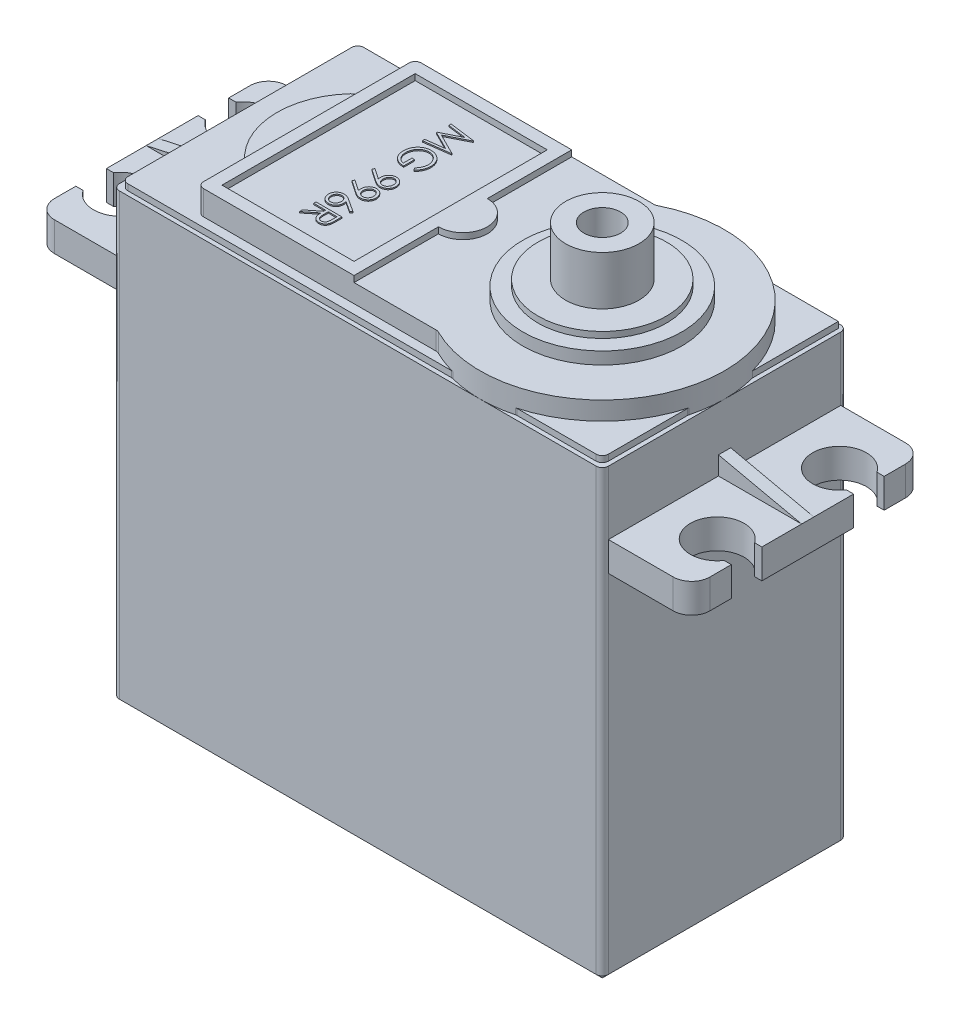
from build123d import *

# Parameters (mm, degrees)
SKETCH2_W                 = 40
SKETCH2_H                 = 20
BOSS_EXTRUDE1_DEPTH       = 38
BOSS_EXTRUDE2_DEPTH       = 2
BOSS_EXTRUDE3_DEPTH       = 0.5
SKETCH5_W                 = 12.8
SKETCH5_H                 = 17.8
SKETCH5_W_2               = 10.8
SKETCH5_H_2               = 15.8
BOSS_EXTRUDE4_DEPTH       = 0.5
BOSS_EXTRUDE5_DEPTH       = 0.5
SKETCH7_R                 = 6.5
BOSS_EXTRUDE6_DEPTH       = 1
SKETCH8_R                 = 5.25
BOSS_EXTRUDE7_DEPTH       = 0.5
SKETCH9_R                 = 3
BOSS_EXTRUDE8_DEPTH       = 4
SKETCH10_R                = 1.5
CUT_EXTRUDE1_DEPTH        = 10
CHAMFER1_SIZE             = 2
SKETCH11_R                = 2.828427125
CUT_EXTRUDE2_DEPTH        = 2
FILLET1_R                 = 0.5
FILLET2_R                 = 0.5
BOSS_EXTRUDE9_DEPTH       = 2.4
BOSS_EXTRUDE10_DEPTH      = 0.5
BOSS_EXTRUDE10_DEPTH_BACK = 0.5
BOSS_EXTRUDE11_DEPTH      = 0.1
FILLET3_R                 = 1.5


with BuildPart() as part:
    # Sketch2 → Boss-Extrude1 (new body)
    with BuildSketch(Plane(origin=(0, 0, 0), x_dir=(1, 0, 0), z_dir=(0, 1, 0))):
        Rectangle(SKETCH2_W, SKETCH2_H)
    extrude(amount=BOSS_EXTRUDE1_DEPTH)

    # Sketch3 → Boss-Extrude2 (add)
    with BuildSketch(Plane(origin=(0, 38, 0), x_dir=(1, 0, 0), z_dir=(0, 1, 0))):
        with BuildLine():
            ThreePointArc((5.440394754, 8.9), (0, 0), (5.440394754, -8.9))
            Line((5.440394754, -8.9), (5.440394754, 8.9))
        make_face()
        with BuildLine():
            Line((5.440394754, 8.9), (5.440394754, -8.9))
            ThreePointArc((5.440394754, -8.9), (15.215551147, -8.532175938), (20, 0))
            ThreePointArc((20, 0), (15.215551147, 8.532175938), (5.440394754, 8.9))
        make_face()
        with BuildLine():
            Line((-14.2, -5), (-14.2, -8.9))
            Line((-14.2, -8.9), (5.440394754, -8.9))
            ThreePointArc((5.440394754, -8.9), (0, 0), (5.440394754, 8.9))
            Line((5.440394754, 8.9), (-14.2, 8.9))
            Line((-14.2, 8.9), (-14.2, 5))
            ThreePointArc((-14.2, 5), (-7.418581742, 5.77726026), (-3.783333333, 0))
            ThreePointArc((-3.783333333, 0), (-7.418581742, -5.77726026), (-14.2, -5))
        make_face()
        with BuildLine():
            ThreePointArc((-14.2, 5), (-16.6, 0), (-14.2, -5))
            Line((-14.2, -5), (-14.2, 5))
        make_face()
        with BuildLine():
            Line((-14.2, 5), (-14.2, -5))
            ThreePointArc((-14.2, -5), (-7.418581742, -5.77726026), (-3.783333333, 0))
            ThreePointArc((-3.783333333, 0), (-7.418581742, 5.77726026), (-14.2, 5))
        make_face()
    extrude(amount=BOSS_EXTRUDE2_DEPTH)

    # Sketch4 → Boss-Extrude3 (add)
    with BuildSketch(Plane(origin=(0, 38, 0), x_dir=(1, 0, 0), z_dir=(0, 1, 0))):
        Polygon((-19.65, 9.65), (-19.65, -9.65), (10, -9.65), (19.65, -9.65), (19.65, 0), (19.65, 9.65), (10, 9.65), align=None)
    extrude(amount=BOSS_EXTRUDE3_DEPTH)

    # Sketch5 → Boss-Extrude4 (add)
    with BuildSketch(Plane(origin=(0, 40, 0), x_dir=(1, 0, 0), z_dir=(0, 1, 0))):
        with Locations((-7.8, 0)):
            Rectangle(SKETCH5_W, SKETCH5_H)
        with Locations((-7.8, 0)):
            Rectangle(SKETCH5_W_2, SKETCH5_H_2, mode=Mode.SUBTRACT)
    extrude(amount=BOSS_EXTRUDE4_DEPTH)

    # Sketch6 → Boss-Extrude5 (add)
    with BuildSketch(Plane(origin=(0, 40, 0), x_dir=(1, 0, 0), z_dir=(0, 1, 0))):
        with BuildLine():
            ThreePointArc((0.6, 0), (0.014213562, 1.414213562), (-1.4, 2))
            Line((-1.4, 2), (-1.4, -2))
            ThreePointArc((-1.4, -2), (0.014213562, -1.414213562), (0.6, 0))
        make_face()
    extrude(amount=BOSS_EXTRUDE5_DEPTH)

    # Sketch7 → Boss-Extrude6 (add)
    with BuildSketch(Plane(origin=(0, 40, 0), x_dir=(1, 0, 0), z_dir=(0, 1, 0))):
        with Locations(Location((10, 0, 0), (0, 0, 270))):
            Circle(SKETCH7_R)
    extrude(amount=BOSS_EXTRUDE6_DEPTH)

    # Sketch8 → Boss-Extrude7 (add)
    with BuildSketch(Plane(origin=(0, 41, 0), x_dir=(1, 0, 0), z_dir=(0, 1, 0))):
        with Locations(Location((10, 0, 0), (0, 0, 270))):
            Circle(SKETCH8_R)
    extrude(amount=BOSS_EXTRUDE7_DEPTH)

    # Sketch9 → Boss-Extrude8 (add)
    with BuildSketch(Plane(origin=(0, 41.5, 0), x_dir=(1, 0, 0), z_dir=(0, 1, 0))):
        with Locations(Location((10, 0, 0), (0, 0, 270))):
            Circle(SKETCH9_R)
    extrude(amount=BOSS_EXTRUDE8_DEPTH)

    # Sketch10 → Cut-Extrude1 (cut)
    with BuildSketch(Plane(origin=(0, 45.5, 0), x_dir=(1, 0, 0), z_dir=(0, 1, 0))):
        with Locations(Location((10, 0, 0), (0, 0, 270))):
            Circle(SKETCH10_R)
    extrude(amount=-CUT_EXTRUDE1_DEPTH, mode=Mode.SUBTRACT)

    # Chamfer1
    chamfer1_edges = [part.edges().sort_by_distance(p)[0] for p in [
        (0, 0, 10),
        (-20, 0, 0),
        (0, 0, -10),
        (20, 0, 0),
    ]]
    chamfer(chamfer1_edges, length=CHAMFER1_SIZE)

    # Sketch11 → Cut-Extrude2 (cut)
    with BuildSketch(Plane.XZ):
        with Locations((-20, 10)):
            Circle(SKETCH11_R)
        with Locations((20, 10)):
            Circle(SKETCH11_R)
        with Locations((20, -10)):
            Circle(SKETCH11_R)
        with Locations((-20, -10)):
            Circle(SKETCH11_R)
    extrude(amount=-CUT_EXTRUDE2_DEPTH, mode=Mode.SUBTRACT)

    # Fillet1
    fillet1_edges = [part.edges().sort_by_distance(p)[0] for p in [
        (20, 20, 10),
        (-20, 20, 10),
        (-20, 20, -10),
        (20, 20, -10),
    ]]
    fillet(fillet1_edges, radius=FILLET1_R)

    # Fillet2
    fillet2_edges = [part.edges().sort_by_distance(p)[0] for p in [
        (5.440394754, 39.25, 8.9),
        (5.440394754, 39.25, -8.9),
        (-14.2, 39.5, -8.9),
        (-14.2, 39.25, -5),
        (-14.2, 39.25, 5),
        (-14.2, 39.5, 8.9),
        (7.377501192, 38.25, 9.65),
        (7.377501192, 38.25, -9.65),
        (19.65, 38.25, 2.622498808),
        (12.622498808, 38.25, 9.65),
        (-19.65, 38.25, 9.65),
        (19.65, 38.25, 9.65),
        (-19.65, 38.25, -9.65),
    ]]
    fillet(fillet2_edges, radius=FILLET2_R)

    # Sketch13 → Boss-Extrude9 (add)
    with BuildSketch(Plane(origin=(0, 32.8, 0), x_dir=(1, 0, 0), z_dir=(0, 1, 0))):
        with BuildLine():
            Line((-26.210386699, -6.25), (-26.8, -6.25))
            Line((-26.8, -6.25), (-26.8, -9.5))
            Line((-26.8, -9.5), (-20, -9.5))
            Line((-20, -9.5), (-20, 9.5))
            Line((-20, 9.5), (-26.8, 9.5))
            Line((-26.8, 9.5), (-26.8, 6.25))
            Line((-26.8, 6.25), (-26.210386699, 6.25))
            ThreePointArc((-26.210386699, 6.25), (-23.745343883, 7.100339346), (-22.2, 5))
            ThreePointArc((-22.2, 5), (-22.844365081, 3.444365081), (-24.4, 2.8))
            Line((-24.4, 2.8), (-24.4, -2.8))
            ThreePointArc((-24.4, -2.8), (-22.844365081, -3.444365081), (-22.2, -5))
            ThreePointArc((-22.2, -5), (-23.745343883, -7.100339346), (-26.210386699, -6.25))
        make_face()
        with BuildLine():
            Line((-26.8, 3.75), (-26.8, -3.75))
            Line((-26.8, -3.75), (-26.210386699, -3.75))
            ThreePointArc((-26.210386699, -3.75), (-25.422252415, -3.051924026), (-24.4, -2.8))
            Line((-24.4, -2.8), (-24.4, 2.8))
            ThreePointArc((-24.4, 2.8), (-25.422252415, 3.051924026), (-26.210386699, 3.75))
            Line((-26.210386699, 3.75), (-26.8, 3.75))
        make_face()
        with BuildLine():
            Line((26.8, 9.5), (20, 9.5))
            Line((20, 9.5), (20, -9.5))
            Line((20, -9.5), (26.8, -9.5))
            Line((26.8, -9.5), (26.8, -6.25))
            Line((26.8, -6.25), (26.210386699, -6.25))
            ThreePointArc((26.210386699, -6.25), (22.451924026, -6.022252415), (24.4, -2.8))
            Line((24.4, -2.8), (24.4, 2.8))
            ThreePointArc((24.4, 2.8), (22.451924026, 6.022252415), (26.210386699, 6.25))
            Line((26.210386699, 6.25), (26.8, 6.25))
            Line((26.8, 6.25), (26.8, 9.5))
        make_face()
        with BuildLine():
            Line((26.8, -3.75), (26.8, 3.75))
            Line((26.8, 3.75), (26.210386699, 3.75))
            ThreePointArc((26.210386699, 3.75), (25.422252415, 3.051924026), (24.4, 2.8))
            Line((24.4, 2.8), (24.4, -2.8))
            ThreePointArc((24.4, -2.8), (25.422252415, -3.051924026), (26.210386699, -3.75))
            Line((26.210386699, -3.75), (26.8, -3.75))
        make_face()
    extrude(amount=-BOSS_EXTRUDE9_DEPTH)

    # Sketch14 → Boss-Extrude10 (add, two sides: drawn at the far end of the back side and taken through both)
    with BuildSketch(Plane.XY.offset(-BOSS_EXTRUDE10_DEPTH_BACK)):
        Polygon((20, 34.3), (26.8, 32.8), (20, 32.8), align=None)
        Polygon((-20, 32.8), (-26.8, 32.8), (-20, 34.3), align=None)
    extrude(amount=BOSS_EXTRUDE10_DEPTH + BOSS_EXTRUDE10_DEPTH_BACK)

    # Sketch15 → Boss-Extrude11 (add)
    # profile 1 of 6: a face of its own
    with BuildSketch(Plane(origin=(0, 40, 0), x_dir=(1, 0, 0), z_dir=(0, 1, 0))):
        Polygon((-8.561548725, 6.200747863), (-6.444882058, 5.921324119), (-6.444882058, 5.894187366), (-8.181634195, 5.020299145), (-6.444882058, 4.148530983), (-6.444882058, 4.120970219), (-8.561548725, 3.839850427), (-8.561548725, 4.030655716), (-7.038498511, 4.233333333), (-8.561548725, 4.997402511), (-8.561548725, 5.040227698), (-7.035106417, 5.807264957), (-8.561548725, 6.009518563), align=None)
    # profile 2 of 6: a face of its own
    with BuildSketch(Plane(origin=(0, 40, 0), x_dir=(1, 0, 0), z_dir=(0, 1, 0))):
        with BuildLine():
            Line((-6.806140071, 1.424679487), (-6.960480348, 1.5875))
            add(Edge.make_bspline(
                [(-6.960480348, 1.5875), (-6.932810967, 1.617141776), (-6.878278885, 1.675561142), (-6.80662192, 1.770186257), (-6.746314601, 1.86944475), (-6.696391634, 1.971860294), (-6.656919261, 2.075604624), (-6.628967869, 2.179013721), (-6.610865102, 2.280971117), (-6.608747952, 2.348670327), (-6.607702571, 2.382098024)],
                knots=[0, 0, 0, 0, 1.09204548, 2.152253107, 3.191356492, 4.216655925, 5.218178745, 6.177092199, 7.099906635, 8, 8, 8, 8], degree=3))
            add(Edge.make_bspline(
                [(-6.607702571, 2.382098024), (-6.607953073, 2.402608227), (-6.608453428, 2.44357544), (-6.61482467, 2.504429471), (-6.624016441, 2.564637149), (-6.637179143, 2.623990847), (-6.654275269, 2.682726549), (-6.674916288, 2.740713594), (-6.699763682, 2.797840051), (-6.728091949, 2.853805452), (-6.759017048, 2.908338456), (-6.793507197, 2.959627677), (-6.830503248, 3.007883988), (-6.87048222, 3.052777152), (-6.912808712, 3.094881359), (-6.958058639, 3.133649558), (-7.005903564, 3.169276199), (-7.056339068, 3.201350739), (-7.108218655, 3.229989232), (-7.161069102, 3.255321041), (-7.214835326, 3.276378841), (-7.269205905, 3.29385362), (-7.324294202, 3.307543871), (-7.380101658, 3.317338355), (-7.436818766, 3.322821216), (-7.474795627, 3.32377344), (-7.493887133, 3.324252137)],
                knots=[0, 0, 0, 0, 1.028345126, 2.054023193, 3.065714254, 4.082262095, 5.100859654, 6.132352297, 7.167492809, 8.223256921, 9.277568108, 10.309840045, 11.320860232, 12.32524711, 13.322830633, 14.313234294, 15.3114222, 16.312425732, 17.308799391, 18.282312954, 19.249923241, 20.202773571, 21.145015718, 22.094907699, 23.042283124, 24, 24, 24, 24], degree=3))
            add(Edge.make_bspline(
                [(-7.493887133, 3.324252137), (-7.513402204, 3.323791035), (-7.552379057, 3.32287009), (-7.610569839, 3.317088711), (-7.667784816, 3.306022676), (-7.724660506, 3.292391015), (-7.780460079, 3.273405367), (-7.835808383, 3.25102033), (-7.890199064, 3.224186229), (-7.943301216, 3.193217907), (-7.995020793, 3.159233867), (-8.04374052, 3.12116956), (-8.09010677, 3.080734487), (-8.133090712, 3.0364576), (-8.173841918, 2.989758138), (-8.211237688, 2.939241006), (-8.245998327, 2.885899516), (-8.277685746, 2.829652298), (-8.305993766, 2.771109663), (-8.331166312, 2.71108296), (-8.35189715, 2.649380424), (-8.368793051, 2.586326321), (-8.382642278, 2.521995819), (-8.391551921, 2.456062376), (-8.398017328, 2.389010786), (-8.398490052, 2.343811708), (-8.398728212, 2.321040331)],
                knots=[0, 0, 0, 0, 0.935842715, 1.869129955, 2.799583258, 3.728257868, 4.6712142, 5.62263184, 6.589468525, 7.576334199, 8.568768874, 9.554260682, 10.538610026, 11.516240982, 12.510802173, 13.508383516, 14.52719334, 15.561971611, 16.601598616, 17.64369662, 18.68095744, 19.719943675, 20.77263142, 21.833597991, 22.908562741, 24, 24, 24, 24], degree=3))
            add(Edge.make_bspline(
                [(-8.398728212, 2.321040331), (-8.398154549, 2.293597235), (-8.397028069, 2.239708258), (-8.388258845, 2.160492649), (-8.374562931, 2.084411739), (-8.354505447, 2.011679341), (-8.328921843, 1.942210858), (-8.298081601, 1.875752074), (-8.260802879, 1.81282455), (-8.218724818, 1.753245395), (-8.171855725, 1.698344593), (-8.121238623, 1.648893856), (-8.067368749, 1.605427514), (-8.009770291, 1.568307131), (-7.949364291, 1.536328164), (-7.885075037, 1.510826334), (-7.817631427, 1.491099952), (-7.771005497, 1.483030405), (-7.74744616, 1.478952991)],
                knots=[0, 0, 0, 0, 1.13011591, 2.219166196, 3.278784489, 4.311187005, 5.322345388, 6.325022048, 7.324448642, 8.33076908, 9.325913853, 10.293360401, 11.241630175, 12.171712957, 13.111744789, 14.052245185, 15.015830637, 16, 16, 16, 16], degree=3))
            Line((-7.74744616, 1.478952991), (-7.74744616, 2.184508547))
            Line((-7.74744616, 2.184508547), (-7.530352143, 2.184508547))
            Line((-7.530352143, 2.184508547), (-7.530352143, 1.288995726))
            add(Edge.make_bspline(
                [(-7.530352143, 1.288995726), (-7.570815244, 1.290027359), (-7.65000884, 1.292046449), (-7.765500385, 1.306209317), (-7.874582314, 1.329079303), (-7.977369505, 1.360321492), (-8.073716297, 1.400765114), (-8.163720511, 1.449976119), (-8.246800694, 1.508742116), (-8.323635092, 1.574969859), (-8.392172282, 1.649295072), (-8.452410159, 1.729709428), (-8.503151264, 1.816345785), (-8.544432712, 1.909122192), (-8.576650795, 2.00773493), (-8.599493606, 2.112412189), (-8.613179345, 2.223012014), (-8.614927941, 2.298810861), (-8.615822229, 2.33757679)],
                knots=[0, 0, 0, 0, 1.140356446, 2.231883559, 3.274166699, 4.278491846, 5.25512956, 6.21435461, 7.1637429, 8.11826594, 9.068280886, 10.0076534, 10.945064095, 11.891975133, 12.864533718, 13.863980011, 14.907571808, 16, 16, 16, 16], degree=3))
            add(Edge.make_bspline(
                [(-8.615822229, 2.33757679), (-8.615478046, 2.361471014), (-8.614799206, 2.408598126), (-8.609974811, 2.478200735), (-8.602547986, 2.545884249), (-8.591332602, 2.611638806), (-8.577595644, 2.67570628), (-8.560005105, 2.737766696), (-8.539643558, 2.798056463), (-8.516483794, 2.856668769), (-8.489649506, 2.913071614), (-8.459828914, 2.967516222), (-8.427175787, 3.020303546), (-8.391125418, 3.071074012), (-8.351947454, 3.120092155), (-8.30956337, 3.167041904), (-8.26410274, 3.212186097), (-8.231821149, 3.240465044), (-8.215555135, 3.254714209)],
                knots=[0, 0, 0, 0, 1.107784379, 2.184907829, 3.233506516, 4.263428166, 5.276301166, 6.270063455, 7.25232949, 8.225834625, 9.190232166, 10.146266622, 11.1027726, 12.066435141, 13.031522626, 14.010570082, 14.99756817, 16, 16, 16, 16], degree=3))
            add(Edge.make_bspline(
                [(-8.215555135, 3.254714209), (-8.189749549, 3.275388559), (-8.138566725, 3.316394084), (-8.056561044, 3.369176589), (-7.971651348, 3.414171723), (-7.883601263, 3.450679882), (-7.792493148, 3.479187201), (-7.698443425, 3.499631935), (-7.601330981, 3.511610629), (-7.535614369, 3.513336339), (-7.502367368, 3.514209402)],
                knots=[0, 0, 0, 0, 1.023165419, 2.029347347, 3.013907458, 3.994755782, 4.975994455, 5.96558838, 6.970761222, 8, 8, 8, 8], degree=3))
            add(Edge.make_bspline(
                [(-7.502367368, 3.514209402), (-7.477471848, 3.513886652), (-7.427997216, 3.513245255), (-7.354540612, 3.505501702), (-7.282406505, 3.494325229), (-7.211528085, 3.478136556), (-7.142220096, 3.456836256), (-7.073949701, 3.43125565), (-7.006990819, 3.401292598), (-6.941932978, 3.366330162), (-6.878813215, 3.328261658), (-6.81956397, 3.285499792), (-6.76316018, 3.240150202), (-6.710623529, 3.190930726), (-6.66172523, 3.138120193), (-6.616284106, 3.082011022), (-6.574184016, 3.022630631), (-6.536102939, 2.959773118), (-6.501895232, 2.89438185), (-6.471905615, 2.826612167), (-6.447120454, 2.756485136), (-6.426090601, 2.684526037), (-6.410539062, 2.610190217), (-6.399261012, 2.534017106), (-6.391543887, 2.455609658), (-6.390923247, 2.402610726), (-6.390608554, 2.375737847)],
                knots=[0, 0, 0, 0, 1.009014138, 2.005204323, 2.991638015, 3.967544938, 4.950092358, 5.929358695, 6.922031709, 7.921874511, 8.922406847, 9.908357674, 10.882125353, 11.855201406, 12.82437151, 13.798139189, 14.780770167, 15.773426639, 16.775664355, 17.771244468, 18.775446331, 19.789330884, 20.808771541, 21.851841802, 22.910785716, 24, 24, 24, 24], degree=3))
            add(Edge.make_bspline(
                [(-6.390608554, 2.375737847), (-6.390958132, 2.353822178), (-6.391651306, 2.31036598), (-6.396480839, 2.245703717), (-6.404050769, 2.182168228), (-6.414636047, 2.119440796), (-6.428638655, 2.057760259), (-6.445703782, 1.996939746), (-6.465461901, 1.937094288), (-6.489044269, 1.878295081), (-6.515806248, 1.820142357), (-6.545931764, 1.762313966), (-6.579934434, 1.705007169), (-6.617915639, 1.648122675), (-6.659222939, 1.59130175), (-6.705037781, 1.535443133), (-6.753553448, 1.479198495), (-6.788437435, 1.443032636), (-6.806140071, 1.424679487)],
                knots=[0, 0, 0, 0, 0.985875312, 1.954874891, 2.915472732, 3.863573565, 4.815313299, 5.759461513, 6.704487138, 7.649063459, 8.607849844, 9.583336382, 10.581114205, 11.603942397, 12.659508253, 13.739925933, 14.853076422, 16, 16, 16, 16], degree=3))
        make_face()
    # profile 3 of 6: a face of its own
    with BuildSketch(Plane(origin=(0, 40, 0), x_dir=(1, 0, 0), z_dir=(0, 1, 0))):
        with BuildLine():
            Line((-8.615822229, -0.230662393), (-8.510243303, -0.078866186))
            Line((-8.510243303, -0.078866186), (-7.649923457, -0.667394498))
            add(Edge.make_bspline(
                [(-7.649923457, -0.667394498), (-7.654515453, -0.629844386), (-7.663557348, -0.555906123), (-7.66521842, -0.481437495), (-7.666035904, -0.444788328)],
                knots=[0, 0, 0, 0, 1.015715272, 2, 2, 2, 2], degree=3))
            add(Edge.make_bspline(
                [(-7.666035904, -0.444788328), (-7.665465089, -0.422568752), (-7.664344629, -0.378953667), (-7.655513825, -0.314821021), (-7.641758816, -0.253105896), (-7.621709949, -0.194043366), (-7.596086972, -0.137686046), (-7.564874842, -0.083837274), (-7.527957379, -0.032568352), (-7.48573141, 0.015517442), (-7.439357742, 0.059248093), (-7.390278343, 0.09820904), (-7.337920379, 0.130588628), (-7.28335261, 0.157486385), (-7.225790547, 0.177885275), (-7.165889245, 0.192739763), (-7.103228871, 0.201885187), (-7.060577958, 0.202973211), (-7.038922523, 0.203525641)],
                knots=[0, 0, 0, 0, 1.060702494, 2.082066239, 3.085748733, 4.076089625, 5.054723785, 6.037561548, 7.043420247, 8.066922603, 9.088643095, 10.08373341, 11.053858765, 12.022809492, 12.983497605, 13.964038393, 14.966267459, 16, 16, 16, 16], degree=3))
            add(Edge.make_bspline(
                [(-7.038922523, 0.203525641), (-7.009308147, 0.202476721), (-6.951181135, 0.200417904), (-6.866252141, 0.183848324), (-6.785947898, 0.156597548), (-6.710479543, 0.118601339), (-6.640932686, 0.070743674), (-6.578274147, 0.013225622), (-6.523395116, -0.053602966), (-6.476221221, -0.128219711), (-6.438281485, -0.208866538), (-6.410317718, -0.293332822), (-6.393868951, -0.380971361), (-6.391700359, -0.440339428), (-6.390608554, -0.470229033)],
                knots=[0, 0, 0, 0, 1.022988612, 2.007919123, 2.978103895, 3.94594894, 4.918897164, 5.887013414, 6.875921846, 7.89917871, 8.930658928, 9.948724884, 10.967259574, 12, 12, 12, 12], degree=3))
            add(Edge.make_bspline(
                [(-6.390608554, -0.470229033), (-6.391711389, -0.499554125), (-6.393890488, -0.557497742), (-6.409989707, -0.642817912), (-6.436834093, -0.724608652), (-6.474101775, -0.802226446), (-6.521118713, -0.873720655), (-6.576681277, -0.938257711), (-6.64141553, -0.994108657), (-6.7135508, -1.041177485), (-6.791062879, -1.078955938), (-6.871969886, -1.106214213), (-6.955692458, -1.122993647), (-7.012415768, -1.125108102), (-7.041042581, -1.126175214)],
                knots=[0, 0, 0, 0, 1.026337322, 2.02794581, 3.027878252, 4.032696425, 5.033228651, 6.015458494, 7.004668777, 8.016190509, 9.023163053, 10.0152653, 10.998354841, 12, 12, 12, 12], degree=3))
            add(Edge.make_bspline(
                [(-7.041042581, -1.126175214), (-7.063265591, -1.125471359), (-7.108339407, -1.124043767), (-7.176756075, -1.113788054), (-7.246659676, -1.097177732), (-7.305904252, -1.077910467), (-7.354338889, -1.058180733), (-7.39320891, -1.041205888), (-7.43377282, -1.021448467), (-7.475732488, -0.997979546), (-7.520191871, -0.973443639), (-7.566180028, -0.945545859), (-7.613953944, -0.915135235), (-7.646154795, -0.893465055), (-7.66264381, -0.882368456)],
                knots=[0, 0, 0, 0, 1.179688711, 2.392703466, 3.66501481, 4.991562144, 5.695278944, 6.441221078, 7.243328977, 8.089575748, 8.993388627, 9.939305498, 10.944784961, 12, 12, 12, 12], degree=3))
            Line((-7.66264381, -0.882368456), (-8.615822229, -0.230662393))
        make_face()
        with BuildLine():
            add(Edge.make_bspline(
                [(-7.448941887, -0.479981303), (-7.448482036, -0.496814255), (-7.447586862, -0.529582289), (-7.442138416, -0.577586655), (-7.432477957, -0.622897959), (-7.418616989, -0.665637239), (-7.401891289, -0.706233032), (-7.380596421, -0.744040525), (-7.355186361, -0.779091361), (-7.326635542, -0.811620251), (-7.294915427, -0.840506098), (-7.261715748, -0.866234502), (-7.22689077, -0.888103036), (-7.190004368, -0.905377018), (-7.151954438, -0.919579594), (-7.112128232, -0.92938763), (-7.070733247, -0.934821013), (-7.04261263, -0.935747251), (-7.028322229, -0.936217949)],
                knots=[0, 0, 0, 0, 1.163407946, 2.26475976, 3.333800367, 4.359385343, 5.366239384, 6.363380779, 7.350133999, 8.353570782, 9.349036268, 10.310270964, 11.253520213, 12.184142, 13.120487599, 14.056272588, 15.012232024, 16, 16, 16, 16], degree=3))
            add(Edge.make_bspline(
                [(-7.028322229, -0.936217949), (-7.014025829, -0.935812995), (-6.985853018, -0.935014984), (-6.944397196, -0.92861166), (-6.904666744, -0.917349802), (-6.86645419, -0.902229162), (-6.830035937, -0.882347874), (-6.795174436, -0.858401984), (-6.761438784, -0.830511008), (-6.730566414, -0.797779052), (-6.701740554, -0.762562584), (-6.676751595, -0.724697037), (-6.655420763, -0.685121664), (-6.637969282, -0.64380493), (-6.624323924, -0.600660833), (-6.614518181, -0.55568704), (-6.609091887, -0.508663884), (-6.608171575, -0.476743724), (-6.607702571, -0.460476763)],
                knots=[0, 0, 0, 0, 0.972051712, 1.915547132, 2.843788449, 3.775556853, 4.704594175, 5.659091977, 6.648619647, 7.675179132, 8.714041218, 9.74046568, 10.755438548, 11.767722258, 12.786148662, 13.828784001, 14.893517844, 16, 16, 16, 16], degree=3))
            add(Edge.make_bspline(
                [(-6.607702571, -0.460476763), (-6.608172247, -0.444351233), (-6.609093748, -0.412713077), (-6.614508827, -0.366108536), (-6.624386378, -0.321436711), (-6.637975872, -0.278425438), (-6.65532584, -0.237195791), (-6.676751434, -0.197935219), (-6.701874032, -0.160464245), (-6.730529707, -0.12525782), (-6.761586997, -0.092596047), (-6.795027032, -0.06421388), (-6.830054393, -0.040323477), (-6.866449285, -0.020414623), (-6.904668053, -0.005301316), (-6.944396841, 0.005962506), (-6.985853111, 0.012365303), (-7.01402586, 0.013163386), (-7.028322229, 0.013568376)],
                knots=[0, 0, 0, 0, 1.099545523, 2.15729926, 3.193054709, 4.213957097, 5.228701859, 6.237665598, 7.258567987, 8.299955741, 9.329010984, 10.327149711, 11.283968076, 12.215264062, 13.149297769, 14.079795814, 15.025585048, 16, 16, 16, 16], degree=3))
            add(Edge.make_bspline(
                [(-7.028322229, 0.013568376), (-7.042623759, 0.013201935), (-7.070828993, 0.012479246), (-7.112271145, 0.005507678), (-7.151996862, -0.006151091), (-7.190392413, -0.021765675), (-7.227084442, -0.042328541), (-7.261898989, -0.067561535), (-7.295230714, -0.097137746), (-7.326561742, -0.130661808), (-7.355319486, -0.1673516), (-7.380435479, -0.206538204), (-7.401645957, -0.24754701), (-7.418664794, -0.290522377), (-7.432339467, -0.335145823), (-7.442120611, -0.381818402), (-7.447534601, -0.430385765), (-7.448468291, -0.463290849), (-7.448941887, -0.479981303)],
                knots=[0, 0, 0, 0, 0.952633368, 1.87876736, 2.791047057, 3.707742249, 4.635551637, 5.587206343, 6.568248508, 7.601284464, 8.641511608, 9.671105535, 10.699146789, 11.713763218, 12.747829548, 13.806491675, 14.887386225, 16, 16, 16, 16], degree=3))
        make_face(mode=Mode.SUBTRACT)
    # profile 4 of 6: a face of its own
    with BuildSketch(Plane(origin=(0, 40, 0), x_dir=(1, 0, 0), z_dir=(0, 1, 0))):
        with BuildLine():
            Line((-8.615822229, -1.858867521), (-8.510243303, -1.707071314))
            Line((-8.510243303, -1.707071314), (-7.649923457, -2.295599626))
            add(Edge.make_bspline(
                [(-7.649923457, -2.295599626), (-7.654515453, -2.258049515), (-7.663557348, -2.184111251), (-7.66521842, -2.109642623), (-7.666035904, -2.072993456)],
                knots=[0, 0, 0, 0, 1.015715272, 2, 2, 2, 2], degree=3))
            add(Edge.make_bspline(
                [(-7.666035904, -2.072993456), (-7.665465089, -2.05077388), (-7.664344629, -2.007158795), (-7.655513825, -1.943026149), (-7.641758816, -1.881311024), (-7.621709949, -1.822248495), (-7.596086972, -1.765891175), (-7.564874842, -1.712042402), (-7.527957379, -1.66077348), (-7.48573141, -1.612687686), (-7.439357742, -1.568957035), (-7.390278343, -1.529996088), (-7.337920379, -1.497616501), (-7.28335261, -1.470718743), (-7.225790547, -1.450319853), (-7.165889245, -1.435465365), (-7.103228871, -1.426319942), (-7.060577958, -1.425231917), (-7.038922523, -1.424679487)],
                knots=[0, 0, 0, 0, 1.060702494, 2.082066239, 3.085748733, 4.076089625, 5.054723785, 6.037561548, 7.043420247, 8.066922603, 9.088643095, 10.08373341, 11.053858765, 12.022809492, 12.983497605, 13.964038393, 14.966267459, 16, 16, 16, 16], degree=3))
            add(Edge.make_bspline(
                [(-7.038922523, -1.424679487), (-7.009308147, -1.425728407), (-6.951181135, -1.427787225), (-6.866252141, -1.444356804), (-6.785947898, -1.471607581), (-6.710479543, -1.509603789), (-6.640932686, -1.557461454), (-6.578274147, -1.614979506), (-6.523395116, -1.681808094), (-6.476221221, -1.756424839), (-6.438281485, -1.837071666), (-6.410317718, -1.92153795), (-6.393868951, -2.009176489), (-6.391700359, -2.068544556), (-6.390608554, -2.098434161)],
                knots=[0, 0, 0, 0, 1.022988612, 2.007919123, 2.978103895, 3.94594894, 4.918897164, 5.887013414, 6.875921846, 7.89917871, 8.930658928, 9.948724884, 10.967259574, 12, 12, 12, 12], degree=3))
            add(Edge.make_bspline(
                [(-6.390608554, -2.098434161), (-6.391711389, -2.127759253), (-6.393890488, -2.18570287), (-6.409989707, -2.271023041), (-6.436834093, -2.35281378), (-6.474101775, -2.430431574), (-6.521118713, -2.501925783), (-6.576681277, -2.566462839), (-6.64141553, -2.622313785), (-6.7135508, -2.669382613), (-6.791062879, -2.707161066), (-6.871969886, -2.734419341), (-6.955692458, -2.751198775), (-7.012415768, -2.75331323), (-7.041042581, -2.754380342)],
                knots=[0, 0, 0, 0, 1.026337322, 2.02794581, 3.027878252, 4.032696425, 5.033228651, 6.015458494, 7.004668777, 8.016190509, 9.023163053, 10.0152653, 10.998354841, 12, 12, 12, 12], degree=3))
            add(Edge.make_bspline(
                [(-7.041042581, -2.754380342), (-7.063265591, -2.753676488), (-7.108339407, -2.752248895), (-7.176756075, -2.741993182), (-7.246659676, -2.72538286), (-7.305904252, -2.706115595), (-7.354338889, -2.686385861), (-7.39320891, -2.669411017), (-7.43377282, -2.649653596), (-7.475732488, -2.626184674), (-7.520191871, -2.601648767), (-7.566180028, -2.573750987), (-7.613953944, -2.543340364), (-7.646154795, -2.521670183), (-7.66264381, -2.510573584)],
                knots=[0, 0, 0, 0, 1.179688711, 2.392703466, 3.66501481, 4.991562144, 5.695278944, 6.441221078, 7.243328977, 8.089575748, 8.993388627, 9.939305498, 10.944784961, 12, 12, 12, 12], degree=3))
            Line((-7.66264381, -2.510573584), (-8.615822229, -1.858867521))
        make_face()
        with BuildLine():
            add(Edge.make_bspline(
                [(-7.448941887, -2.108186432), (-7.448482036, -2.125019383), (-7.447586862, -2.157787417), (-7.442138416, -2.205791783), (-7.432477957, -2.251103087), (-7.418616989, -2.293842367), (-7.401891289, -2.33443816), (-7.380596421, -2.372245654), (-7.355186361, -2.407296489), (-7.326635542, -2.439825379), (-7.294915427, -2.468711226), (-7.261715748, -2.49443963), (-7.22689077, -2.516308164), (-7.190004368, -2.533582146), (-7.151954438, -2.547784723), (-7.112128232, -2.557592758), (-7.070733247, -2.563026141), (-7.04261263, -2.563952379), (-7.028322229, -2.564423077)],
                knots=[0, 0, 0, 0, 1.163407946, 2.26475976, 3.333800367, 4.359385343, 5.366239384, 6.363380779, 7.350133999, 8.353570782, 9.349036268, 10.310270964, 11.253520213, 12.184142, 13.120487599, 14.056272588, 15.012232024, 16, 16, 16, 16], degree=3))
            add(Edge.make_bspline(
                [(-7.028322229, -2.564423077), (-7.014025829, -2.564018123), (-6.985853018, -2.563220112), (-6.944397196, -2.556816789), (-6.904666744, -2.54555493), (-6.86645419, -2.53043429), (-6.830035937, -2.510553003), (-6.795174436, -2.486607112), (-6.761438784, -2.458716136), (-6.730566414, -2.42598418), (-6.701740554, -2.390767712), (-6.676751595, -2.352902165), (-6.655420763, -2.313326792), (-6.637969282, -2.272010058), (-6.624323924, -2.228865961), (-6.614518181, -2.183892169), (-6.609091887, -2.136869012), (-6.608171575, -2.104948853), (-6.607702571, -2.088681891)],
                knots=[0, 0, 0, 0, 0.972051712, 1.915547132, 2.843788449, 3.775556853, 4.704594175, 5.659091977, 6.648619647, 7.675179132, 8.714041218, 9.74046568, 10.755438548, 11.767722258, 12.786148662, 13.828784001, 14.893517844, 16, 16, 16, 16], degree=3))
            add(Edge.make_bspline(
                [(-6.607702571, -2.088681891), (-6.608172247, -2.072556362), (-6.609093748, -2.040918206), (-6.614508827, -1.994313664), (-6.624386378, -1.949641839), (-6.637975872, -1.906630566), (-6.65532584, -1.865400919), (-6.676751434, -1.826140347), (-6.701874032, -1.788669373), (-6.730529707, -1.753462949), (-6.761586997, -1.720801175), (-6.795027032, -1.692419008), (-6.830054393, -1.668528605), (-6.866449285, -1.648619751), (-6.904668053, -1.633506444), (-6.944396841, -1.622242622), (-6.985853111, -1.615839826), (-7.01402586, -1.615041742), (-7.028322229, -1.614636752)],
                knots=[0, 0, 0, 0, 1.099545523, 2.15729926, 3.193054709, 4.213957097, 5.228701859, 6.237665598, 7.258567987, 8.299955741, 9.329010984, 10.327149711, 11.283968076, 12.215264062, 13.149297769, 14.079795814, 15.025585048, 16, 16, 16, 16], degree=3))
            add(Edge.make_bspline(
                [(-7.028322229, -1.614636752), (-7.042623759, -1.615003193), (-7.070828993, -1.615725882), (-7.112271145, -1.62269745), (-7.151996862, -1.634356219), (-7.190392413, -1.649970803), (-7.227084442, -1.67053367), (-7.261898989, -1.695766663), (-7.295230714, -1.725342874), (-7.326561742, -1.758866936), (-7.355319486, -1.795556729), (-7.380435479, -1.834743332), (-7.401645957, -1.875752138), (-7.418664794, -1.918727506), (-7.432339467, -1.963350951), (-7.442120611, -2.010023531), (-7.447534601, -2.058590893), (-7.448468291, -2.091495978), (-7.448941887, -2.108186432)],
                knots=[0, 0, 0, 0, 0.952633368, 1.87876736, 2.791047057, 3.707742249, 4.635551637, 5.587206343, 6.568248508, 7.601284464, 8.641511608, 9.671105535, 10.699146789, 11.713763218, 12.747829548, 13.806491675, 14.887386225, 16, 16, 16, 16], degree=3))
        make_face(mode=Mode.SUBTRACT)
    # profile 5 of 6: a face of its own
    with BuildSketch(Plane(origin=(0, 40, 0), x_dir=(1, 0, 0), z_dir=(0, 1, 0))):
        with BuildLine():
            Line((-6.390608554, -4.00267094), (-6.505515738, -4.148954995))
            Line((-6.505515738, -4.148954995), (-7.360747442, -3.589683494))
            add(Edge.make_bspline(
                [(-7.360747442, -3.589683494), (-7.354812393, -3.626918852), (-7.343235409, -3.699550627), (-7.341325604, -3.773069052), (-7.340394878, -3.808897569)],
                knots=[0, 0, 0, 0, 1.025318673, 2, 2, 2, 2], degree=3))
            add(Edge.make_bspline(
                [(-7.340394878, -3.808897569), (-7.340973098, -3.83041046), (-7.342111307, -3.872757945), (-7.350870588, -3.934931583), (-7.364674346, -3.994675368), (-7.384796139, -4.051741676), (-7.410499944, -4.106335337), (-7.441305832, -4.158769643), (-7.478804506, -4.208058954), (-7.520693312, -4.254838), (-7.567088822, -4.297308673), (-7.616317249, -4.334910383), (-7.668327306, -4.366495157), (-7.723092649, -4.392121291), (-7.780528858, -4.412020908), (-7.840562447, -4.426527722), (-7.903234813, -4.435102999), (-7.945857329, -4.436267463), (-7.96750826, -4.436858974)],
                knots=[0, 0, 0, 0, 1.04369286, 2.054478336, 3.041073146, 4.015093852, 4.984733326, 5.965804835, 6.960378782, 7.985147595, 9.009457201, 10.008161701, 10.986880575, 11.956520048, 12.937015923, 13.931873656, 14.949455224, 16, 16, 16, 16], degree=3))
            add(Edge.make_bspline(
                [(-7.96750826, -4.436858974), (-7.99711171, -4.435754359), (-8.055329948, -4.43358202), (-8.140478861, -4.417768313), (-8.220947324, -4.390477389), (-8.297051566, -4.353965404), (-8.366577328, -4.306593975), (-8.429409974, -4.250456228), (-8.484177856, -4.185021503), (-8.53116094, -4.111839309), (-8.568488941, -4.032633448), (-8.596086294, -3.949583511), (-8.612576414, -3.863399366), (-8.614735314, -3.804868473), (-8.615822229, -3.775400641)],
                knots=[0, 0, 0, 0, 1.031881447, 2.029301251, 3.006342947, 3.987068354, 4.962916383, 5.929513747, 6.915671209, 7.928552063, 8.953527267, 9.960179832, 10.973036711, 12, 12, 12, 12], degree=3))
            add(Edge.make_bspline(
                [(-8.615822229, -3.775400641), (-8.614898031, -3.746918345), (-8.613067356, -3.690499904), (-8.596759349, -3.607506818), (-8.570327088, -3.527760785), (-8.5339113, -3.451822351), (-8.487916199, -3.381471818), (-8.432536151, -3.318552584), (-8.368995118, -3.263283559), (-8.29709818, -3.217530585), (-8.22033777, -3.180241787), (-8.139569144, -3.153941459), (-8.056417804, -3.136932968), (-7.999815712, -3.13517817), (-7.971324366, -3.134294872)],
                knots=[0, 0, 0, 0, 1.011913813, 2.004424092, 2.994488568, 3.992479987, 4.990471406, 5.973328987, 6.963763268, 7.974390938, 8.994854117, 9.989689954, 10.988086187, 12, 12, 12, 12], degree=3))
            add(Edge.make_bspline(
                [(-7.971324366, -3.134294872), (-7.949533912, -3.135061981), (-7.905061767, -3.136627574), (-7.83751262, -3.145970856), (-7.768666184, -3.163107575), (-7.710303241, -3.181653251), (-7.661968151, -3.20005616), (-7.623799206, -3.21711976), (-7.583491576, -3.236198945), (-7.541807919, -3.258562406), (-7.497557243, -3.28226948), (-7.452378286, -3.309962032), (-7.404620973, -3.338859636), (-7.372824895, -3.360029284), (-7.356507325, -3.370893429)],
                knots=[0, 0, 0, 0, 1.17367173, 2.395347028, 3.66355231, 4.98980831, 5.690886799, 6.447442954, 7.240630024, 8.091733897, 8.994365608, 9.943299771, 10.944512865, 12, 12, 12, 12], degree=3))
            Line((-7.356507325, -3.370893429), (-6.390608554, -4.00267094))
        make_face()
        with BuildLine():
            add(Edge.make_bspline(
                [(-7.557488895, -3.769040465), (-7.55796566, -3.752916661), (-7.558901067, -3.72128189), (-7.564184256, -3.674927657), (-7.574194451, -3.63117484), (-7.587142868, -3.589523709), (-7.604773044, -3.550408379), (-7.625934253, -3.513382659), (-7.651093547, -3.478813954), (-7.679970407, -3.447309348), (-7.711124571, -3.418380339), (-7.744693386, -3.393496667), (-7.779651265, -3.372008605), (-7.81632677, -3.354543422), (-7.854696374, -3.340941894), (-7.89458613, -3.331103581), (-7.936262846, -3.325628189), (-7.964524888, -3.324717281), (-7.978956577, -3.324252137)],
                knots=[0, 0, 0, 0, 1.129474985, 2.216020618, 3.260639938, 4.268601163, 5.26556745, 6.258792394, 7.250684778, 8.252748164, 9.247500881, 10.223461414, 11.174097059, 12.117127289, 13.062595836, 14.020469732, 14.98917545, 16, 16, 16, 16], degree=3))
            add(Edge.make_bspline(
                [(-7.978956577, -3.324252137), (-7.99325864, -3.324631912), (-8.021302855, -3.325376596), (-8.062639556, -3.332107166), (-8.102382527, -3.342461577), (-8.140560837, -3.357617691), (-8.176966227, -3.37662789), (-8.211857297, -3.400022036), (-8.245258129, -3.427404009), (-8.276326473, -3.45923501), (-8.304823113, -3.493561658), (-8.330196575, -3.529864362), (-8.351503498, -3.568027694), (-8.3683483, -3.608269417), (-8.382144594, -3.650026115), (-8.391859881, -3.693616336), (-8.397350919, -3.739078381), (-8.398263088, -3.769873979), (-8.398728212, -3.785576923)],
                knots=[0, 0, 0, 0, 0.989642335, 1.94054129, 2.892446913, 3.828371744, 4.778262963, 5.730973156, 6.732161388, 7.763274768, 8.805796303, 9.818398792, 10.825975928, 11.825728216, 12.834635236, 13.867465554, 14.912602056, 16, 16, 16, 16], degree=3))
            add(Edge.make_bspline(
                [(-8.398728212, -3.785576923), (-8.398263125, -3.801279893), (-8.397351027, -3.832075541), (-8.391859471, -3.877537221), (-8.3821461, -3.921128794), (-8.368342841, -3.962880578), (-8.351523748, -4.003140438), (-8.330063063, -4.041337176), (-8.304977385, -4.077986475), (-8.276277427, -4.112290604), (-8.24543368, -4.144254649), (-8.211554876, -4.170995277), (-8.177243536, -4.195128497), (-8.140415763, -4.213408567), (-8.10240551, -4.228733473), (-8.062633399, -4.239035642), (-8.021304467, -4.24578014), (-7.993259184, -4.24652291), (-7.978956577, -4.246901709)],
                knots=[0, 0, 0, 0, 1.087205562, 2.132157158, 3.164804748, 4.173533273, 5.173108684, 6.180507559, 7.20098426, 8.243321352, 9.274252308, 10.269075238, 11.227079059, 12.172305571, 13.108064818, 14.05980203, 15.010532752, 16, 16, 16, 16], degree=3))
            add(Edge.make_bspline(
                [(-7.978956577, -4.246901709), (-7.964504386, -4.246572792), (-7.936139434, -4.245927234), (-7.894623679, -4.238484223), (-7.854372005, -4.228431197), (-7.816291144, -4.212184586), (-7.779328009, -4.192833546), (-7.744539033, -4.168181593), (-7.710938638, -4.139917525), (-7.679763788, -4.107184991), (-7.651248732, -4.071574925), (-7.626079417, -4.033706215), (-7.604837009, -3.994089801), (-7.587113233, -3.952763953), (-7.574322825, -3.909255661), (-7.564251581, -3.864267211), (-7.55889217, -3.817223242), (-7.557962611, -3.78530596), (-7.557488895, -3.769040465)],
                knots=[0, 0, 0, 0, 0.978265087, 1.920016216, 2.851775529, 3.783928695, 4.718195979, 5.674835085, 6.667117013, 7.690134047, 8.732874136, 9.755756613, 10.767227014, 11.776017537, 12.797239016, 13.836276431, 14.897336092, 16, 16, 16, 16], degree=3))
        make_face(mode=Mode.SUBTRACT)
    # profile 6 of 6: a face of its own
    with BuildSketch(Plane(origin=(0, 40, 0), x_dir=(1, 0, 0), z_dir=(0, 1, 0))):
        with BuildLine():
            Line((-6.444882058, -4.843910256), (-6.444882058, -5.267497997))
            add(Edge.make_bspline(
                [(-6.444882058, -5.267497997), (-6.44497615, -5.295765251), (-6.445156818, -5.350041509), (-6.446164208, -5.427797725), (-6.449051557, -5.498450303), (-6.451536271, -5.561962301), (-6.456067112, -5.618332554), (-6.460397599, -5.667733916), (-6.466066432, -5.709938857), (-6.47133114, -5.735487538), (-6.473714857, -5.747055288)],
                knots=[0, 0, 0, 0, 1.410062039, 2.707475311, 3.878576406, 4.937260626, 5.877586885, 6.699081471, 7.410979367, 8, 8, 8, 8], degree=3))
            add(Edge.make_bspline(
                [(-6.473714857, -5.747055288), (-6.47754061, -5.762541472), (-6.485110501, -5.793183477), (-6.501118557, -5.83729694), (-6.519612907, -5.879351155), (-6.541503811, -5.919188304), (-6.566409445, -5.956812082), (-6.594475323, -5.992166157), (-6.625844373, -6.025048399), (-6.659715564, -6.055711822), (-6.69638443, -6.083507227), (-6.735316805, -6.107560514), (-6.776269191, -6.128157222), (-6.819384199, -6.144600194), (-6.864297363, -6.157828061), (-6.911400858, -6.167158117), (-6.960484112, -6.172752647), (-6.993962441, -6.173322278), (-7.010937747, -6.173611111)],
                knots=[0, 0, 0, 0, 1.02737288, 2.032829108, 3.019628684, 3.985738875, 4.958353778, 5.924249254, 6.890702889, 7.883913451, 8.865824512, 9.85161466, 10.829249435, 11.81541824, 12.821369441, 13.843154991, 14.906364023, 16, 16, 16, 16], degree=3))
            add(Edge.make_bspline(
                [(-7.010937747, -6.173611111), (-7.039140914, -6.17272274), (-7.094172598, -6.170989298), (-7.174037535, -6.154826651), (-7.248539397, -6.128353458), (-7.317574504, -6.091867892), (-7.379833545, -6.045426457), (-7.434332736, -5.989614413), (-7.480359785, -5.924716787), (-7.511938398, -5.864017709), (-7.532257431, -5.810373886), (-7.546625747, -5.766081324), (-7.557539871, -5.717728938), (-7.567459284, -5.666010417), (-7.575028594, -5.610526282), (-7.580404242, -5.551388264), (-7.583860825, -5.488448456), (-7.584365847, -5.445304886), (-7.584625648, -5.42311031)],
                knots=[0, 0, 0, 0, 1.260402266, 2.459371274, 3.627181936, 4.786749125, 5.93865593, 7.087644312, 8.261344208, 9.485713728, 10.136162886, 10.825977872, 11.566646758, 12.35154167, 13.181268117, 14.0701832, 15.007234106, 16, 16, 16, 16], degree=3))
            Line((-7.584625648, -5.42311031), (-8.561548725, -6.200747863))
            Line((-8.561548725, -6.200747863), (-8.561548725, -5.965845353))
            Line((-8.561548725, -5.965845353), (-7.584625648, -5.188207799))
            Line((-7.584625648, -5.188207799), (-7.584625648, -5.033867521))
            Line((-7.584625648, -5.033867521), (-8.561548725, -5.033867521))
            Line((-8.561548725, -5.033867521), (-8.561548725, -4.843910256))
            Line((-8.561548725, -4.843910256), (-6.444882058, -4.843910256))
        make_face()
        with BuildLine():
            Line((-6.661976075, -5.033867521), (-7.367531631, -5.033867521))
            Line((-7.367531631, -5.033867521), (-7.370499713, -5.421414263))
            add(Edge.make_bspline(
                [(-7.370499713, -5.421414263), (-7.370507718, -5.439508762), (-7.370523234, -5.474581056), (-7.368107951, -5.525320983), (-7.365360322, -5.572565047), (-7.361157632, -5.616132561), (-7.355741311, -5.656042924), (-7.348966269, -5.692276398), (-7.341072568, -5.724891439), (-7.328856702, -5.762931781), (-7.30949184, -5.805396659), (-7.28136548, -5.851604123), (-7.245759745, -5.890820014), (-7.205692233, -5.924631712), (-7.16073279, -5.950675332), (-7.112876995, -5.969630517), (-7.062538003, -5.981525953), (-7.027962649, -5.982940152), (-7.010513735, -5.983653846)],
                knots=[0, 0, 0, 0, 1.14660753, 2.222451964, 3.218720504, 4.145691244, 4.995719623, 5.770487122, 6.480909919, 7.121111896, 8.299844659, 9.430703709, 10.534634535, 11.641396424, 12.741395289, 13.810956493, 14.895269934, 16, 16, 16, 16], degree=3))
            add(Edge.make_bspline(
                [(-7.010513735, -5.983653846), (-6.993487039, -5.982937958), (-6.959746341, -5.981519328), (-6.910486405, -5.969607469), (-6.863661589, -5.950371559), (-6.820164404, -5.92339836), (-6.780351723, -5.890805387), (-6.746757854, -5.852096384), (-6.718624947, -5.809220786), (-6.700778337, -5.769118889), (-6.68981488, -5.733299957), (-6.68210951, -5.702195778), (-6.675866644, -5.666917132), (-6.671012934, -5.627548564), (-6.66664515, -5.584161299), (-6.663813194, -5.536636535), (-6.66210156, -5.485029152), (-6.662018877, -5.44925919), (-6.661976075, -5.430742521)],
                knots=[0, 0, 0, 0, 1.100801541, 2.181386982, 3.260112282, 4.364594493, 5.481957178, 6.577424609, 7.668452592, 8.790448866, 9.403819393, 10.091598921, 10.863153553, 11.720938239, 12.658472417, 13.685008818, 14.801622349, 16, 16, 16, 16], degree=3))
            Line((-6.661976075, -5.430742521), (-6.661976075, -5.033867521))
        make_face(mode=Mode.SUBTRACT)
    extrude(amount=BOSS_EXTRUDE11_DEPTH)

    # Fillet3
    fillet3_edges = [part.edges().sort_by_distance(p)[0] for p in [
        (-26.8, 31.6, -9.5),
        (-26.8, 31.6, 9.5),
        (26.8, 31.6, 9.5),
        (26.8, 31.6, -9.5),
    ]]
    fillet(fillet3_edges, radius=FILLET3_R)


solid = part.part
